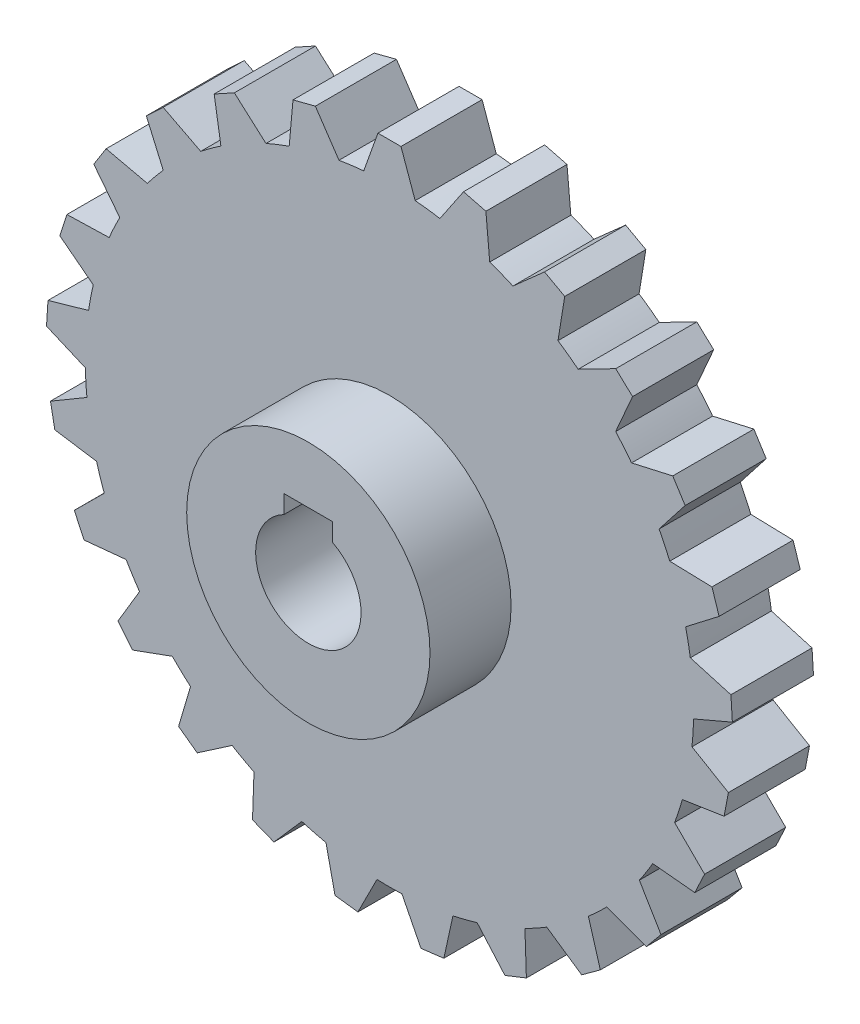
from build123d import *

# Parameters (mm, degrees)
BOSS_EXTRUDE1_DEPTH = 20
SKETCH3_R           = 30
BOSS_EXTRUDE2_DEPTH = 20
CUT_EXTRUDE1_DEPTH  = 127.092159028


with BuildPart() as part:
    # Sketch1 → Boss-Extrude1 (new body)
    with BuildSketch(Plane.XY):
        with BuildLine():
            Line((6.339757092, 74.731569501), (2.843370149, 84.549554706))
            Line((2.843370149, 84.549554706), (-2.843370149, 84.549554706))
            Line((-2.843370149, 84.549554706), (-6.339757092, 74.731569501))
            ThreePointArc((-6.339757092, 74.731569501), (-9.399992517, 74.408602599), (-12.444403622, 73.960373299))
            Line((-12.444403622, 73.960373299), (-18.272578772, 82.600392371))
            Line((-18.272578772, 82.600392371), (-23.780659667, 81.186157568))
            Line((-23.780659667, 81.186157568), (-24.725567552, 70.807106347))
            ThreePointArc((-24.725567552, 70.807106347), (-27.609341451, 69.733236442), (-30.446636689, 68.541974836))
            Line((-30.446636689, 68.541974836), (-38.240394368, 75.4611436))
            Line((-38.240394368, 75.4611436), (-43.223722879, 72.721535567))
            Line((-43.223722879, 72.721535567), (-41.557779668, 62.433572291))
            ThreePointArc((-41.557779668, 62.433572291), (-44.083893922, 60.676274578), (-46.535795597, 58.816832014))
            Line((-46.535795597, 58.816832014), (-55.805425347, 63.58039365))
            Line((-55.805425347, 63.58039365), (-59.950880617, 59.687552036))
            Line((-59.950880617, 59.687552036), (-55.778763649, 50.137107274))
            ThreePointArc((-55.778763649, 50.137107274), (-57.788493208, 47.806799231), (-59.700939322, 45.396011323))
            Line((-59.700939322, 45.396011323), (-69.863996213, 47.704653735))
            Line((-69.863996213, 47.704653735), (-72.911104041, 42.903180095))
            Line((-72.911104041, 42.903180095), (-66.49496277, 34.690343415))
            ThreePointArc((-66.49496277, 34.690343415), (-67.862028935, 31.933446867), (-69.114853465, 29.122792286))
            Line((-69.114853465, 29.122792286), (-79.532755256, 28.83145498))
            Line((-79.532755256, 28.83145498), (-81.290054651, 23.423043562))
            Line((-81.290054651, 23.423043562), (-73.033038828, 17.063857698))
            ThreePointArc((-73.033038828, 17.063857698), (-73.671543805, 14.053598594), (-74.186027177, 11.019681104))
            Line((-74.186027177, 11.019681104), (-84.204178785, 8.146669874))
            Line((-84.204178785, 8.146669874), (-84.561252162, 2.471151058))
            Line((-84.561252162, 2.471151058), (-74.98218046, -1.634812956))
            ThreePointArc((-74.98218046, -1.634812956), (-74.852004632, -4.709288965), (-74.595819965, -7.77583717))
            Line((-74.595819965, -7.77583717), (-83.584744079, -13.050000462))
            Line((-83.584744079, -13.050000462), (-82.519155206, -18.636012955))
            Line((-82.519155206, -18.636012955), (-72.219915929, -20.230762298))
            ThreePointArc((-72.219915929, -20.230762298), (-71.329238722, -23.176274578), (-70.318483041, -26.082770996))
            Line((-70.318483041, -26.082770996), (-77.7133725, -33.426691274))
            Line((-77.7133725, -33.426691274), (-75.292076244, -38.572207736))
            Line((-75.292076244, -38.572207736), (-64.919808474, -37.555538443))
            ThreePointArc((-64.919808474, -37.555538443), (-63.324594413, -40.187009623), (-61.622777213, -42.750828396))
            Line((-61.622777213, -42.750828396), (-66.958983917, -51.703060138))
            Line((-66.958983917, -51.703060138), (-63.334119227, -56.084768847))
            Line((-63.334119227, -56.084768847), (-53.540550694, -52.520561987))
            ThreePointArc((-53.540550694, -52.520561987), (-51.341032945, -54.672647057), (-49.055085661, -56.73269402))
            Line((-49.055085661, -56.73269402), (-51.997316116, -66.730735583))
            Line((-51.997316116, -66.730735583), (-47.396646572, -70.073317665))
            Line((-47.396646572, -70.073317665), (-38.797143205, -64.185525464))
            ThreePointArc((-38.797143205, -64.185525464), (-36.131525558, -65.723001003), (-33.405082664, -67.149835831))
            Line((-33.405082664, -67.149835831), (-33.768465712, -77.565473494))
            Line((-33.768465712, -77.565473494), (-28.4810683, -79.658902223))
            Line((-28.4810683, -79.658902223), (-21.615968523, -71.817476319))
            ThreePointArc((-21.615968523, -71.817476319), (-18.651741537, -72.643737085), (-15.656115469, -73.347706497))
            Line((-15.656115469, -73.347706497), (-13.417818414, -83.526487439))
            Line((-13.417818414, -83.526487439), (-7.775919761, -84.239224989))
            Line((-7.775919761, -84.239224989), (-3.076583041, -74.93687101))
            ThreePointArc((-3.076583041, -74.93687101), (0, -75), (3.076583041, -74.93687101))
            Line((3.076583041, -74.93687101), (7.775919761, -84.239224989))
            Line((7.775919761, -84.239224989), (13.417818414, -83.526487439))
            Line((13.417818414, -83.526487439), (15.656115469, -73.347706497))
            ThreePointArc((15.656115469, -73.347706497), (18.651741537, -72.643737085), (21.615968523, -71.817476319))
            Line((21.615968523, -71.817476319), (28.4810683, -79.658902223))
            Line((28.4810683, -79.658902223), (33.768465712, -77.565473494))
            Line((33.768465712, -77.565473494), (33.405082664, -67.149835831))
            ThreePointArc((33.405082664, -67.149835831), (36.131525558, -65.723001003), (38.797143205, -64.185525464))
            Line((38.797143205, -64.185525464), (47.396646572, -70.073317665))
            Line((47.396646572, -70.073317665), (51.997316116, -66.730735583))
            Line((51.997316116, -66.730735583), (49.055085661, -56.73269402))
            ThreePointArc((49.055085661, -56.73269402), (51.341032945, -54.672647057), (53.540550694, -52.520561987))
            Line((53.540550694, -52.520561987), (63.334119227, -56.084768847))
            Line((63.334119227, -56.084768847), (66.958983917, -51.703060138))
            Line((66.958983917, -51.703060138), (61.622777213, -42.750828396))
            ThreePointArc((61.622777213, -42.750828396), (63.324594413, -40.187009623), (64.919808474, -37.555538443))
            Line((64.919808474, -37.555538443), (75.292076244, -38.572207736))
            Line((75.292076244, -38.572207736), (77.7133725, -33.426691274))
            Line((77.7133725, -33.426691274), (70.318483041, -26.082770996))
            ThreePointArc((70.318483041, -26.082770996), (71.329238722, -23.176274578), (72.219915929, -20.230762298))
            Line((72.219915929, -20.230762298), (82.519155206, -18.636012955))
            Line((82.519155206, -18.636012955), (83.584744079, -13.050000462))
            Line((83.584744079, -13.050000462), (74.595819965, -7.77583717))
            ThreePointArc((74.595819965, -7.77583717), (74.852004632, -4.709288965), (74.98218046, -1.634812956))
            Line((74.98218046, -1.634812956), (84.561252162, 2.471151058))
            Line((84.561252162, 2.471151058), (84.204178785, 8.146669874))
            Line((84.204178785, 8.146669874), (74.186027177, 11.019681104))
            ThreePointArc((74.186027177, 11.019681104), (73.671543805, 14.053598594), (73.033038828, 17.063857698))
            Line((73.033038828, 17.063857698), (81.290054651, 23.423043562))
            Line((81.290054651, 23.423043562), (79.532755256, 28.83145498))
            Line((79.532755256, 28.83145498), (69.114853465, 29.122792286))
            ThreePointArc((69.114853465, 29.122792286), (67.862028935, 31.933446867), (66.49496277, 34.690343415))
            Line((66.49496277, 34.690343415), (72.911104041, 42.903180095))
            Line((72.911104041, 42.903180095), (69.863996213, 47.704653735))
            Line((69.863996213, 47.704653735), (59.700939322, 45.396011323))
            ThreePointArc((59.700939322, 45.396011323), (57.788493208, 47.806799231), (55.778763649, 50.137107274))
            Line((55.778763649, 50.137107274), (59.950880617, 59.687552036))
            Line((59.950880617, 59.687552036), (55.805425347, 63.58039365))
            Line((55.805425347, 63.58039365), (46.535795597, 58.816832014))
            ThreePointArc((46.535795597, 58.816832014), (44.083893922, 60.676274578), (41.557779668, 62.433572291))
            Line((41.557779668, 62.433572291), (43.223722879, 72.721535567))
            Line((43.223722879, 72.721535567), (38.240394368, 75.4611436))
            Line((38.240394368, 75.4611436), (30.446636689, 68.541974836))
            ThreePointArc((30.446636689, 68.541974836), (27.609341451, 69.733236442), (24.725567552, 70.807106347))
            Line((24.725567552, 70.807106347), (23.780659667, 81.186157568))
            Line((23.780659667, 81.186157568), (18.272578772, 82.600392371))
            Line((18.272578772, 82.600392371), (12.444403622, 73.960373299))
            ThreePointArc((12.444403622, 73.960373299), (9.399992517, 74.408602599), (6.339757092, 74.731569501))
        make_face()
    extrude(amount=BOSS_EXTRUDE1_DEPTH)

    # Sketch3 → Boss-Extrude2 (add)
    with BuildSketch(Plane.XY.offset(20)):
        Circle(SKETCH3_R)
    extrude(amount=BOSS_EXTRUDE2_DEPTH)

    # Sketch4 → Cut-Extrude1 (cut, through all)
    with BuildSketch(Plane.XY.offset(40)):
        with BuildLine():
            Line((-6, 16), (6, 16))
            Line((6, 16), (6, 11.532562595))
            ThreePointArc((6, 11.532562595), (0, -13), (-6, 11.532562595))
            Line((-6, 11.532562595), (-6, 16))
        make_face()
    extrude(amount=-CUT_EXTRUDE1_DEPTH, mode=Mode.SUBTRACT)


solid = part.part
